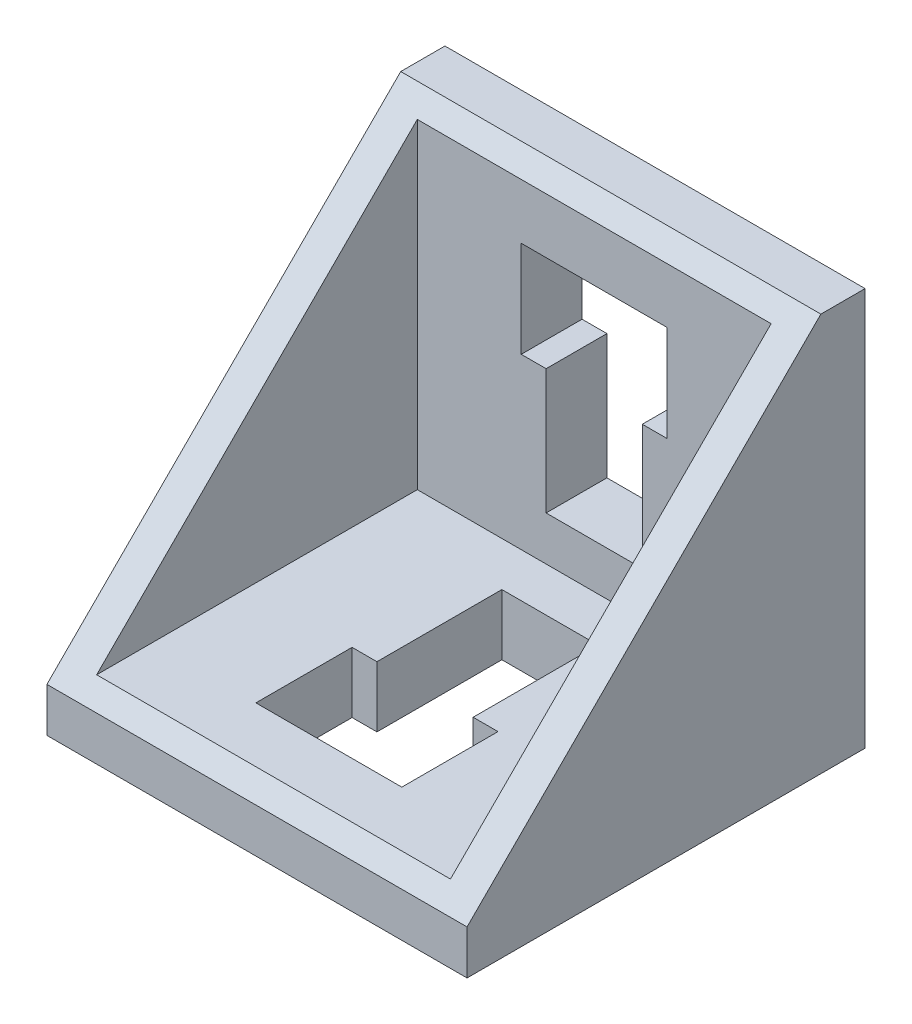
from build123d import *

# Parameters (mm, degrees)
ESTRUSIONE_ESTRUSIONE1_DEPTH = 38
TAGLIO_ESTRUSIONE1_DEPTH     = 32
TAGLIO_ESTRUSIONE3_DEPTH     = 48.370877129
TAGLIO_ESTRUSIONE4_DEPTH     = 53.671149598
TAGLIO_ESTRUSIONE5_DEPTH     = 53.671149598


with BuildPart() as part:
    # Schizzo2 → Estrusione-Estrusione1 (new body)
    with BuildSketch(Plane(origin=(0, 0, 0), x_dir=(0, 0, -1), z_dir=(1, 0, 0))):
        Polygon((-20, -20), (20, -20), (20, 20), align=None)
    extrude(amount=ESTRUSIONE_ESTRUSIONE1_DEPTH)

    # Schizzo3 → Taglio-Estrusione1 (cut)
    with BuildSketch(Plane(origin=(35, 0, 0), x_dir=(0, 0, -1), z_dir=(1, 0, 0))):
        Polygon((-20, -14.5), (14.5, 20), (14.5, -14.5), align=None)
    extrude(amount=-TAGLIO_ESTRUSIONE1_DEPTH, mode=Mode.SUBTRACT)

    # Schizzo5 → Taglio-Estrusione3 (cut, through all)
    with BuildSketch(Plane(origin=(0, 0, 0), x_dir=(0, 0, -1), z_dir=(1, 0, 0))):
        Polygon((16, 16), (20, 16), (20, 20), align=None)
        Polygon((-20, -20), (-16, -16), (-16, -20), align=None)
    extrude(amount=TAGLIO_ESTRUSIONE3_DEPTH, mode=Mode.SUBTRACT)

    # Schizzo6 → Taglio-Estrusione4 (cut, through all)
    with BuildSketch(Plane.XY.offset(-14.5)):
        Polygon((25.6, 9.5), (12.4, 9.5), (12.4, 0.8), (14.65, 0.8), (14.65, -10.5), (23.35, -10.5), (23.35, 0.8), (25.6, 0.8), align=None)
    extrude(amount=-TAGLIO_ESTRUSIONE4_DEPTH, mode=Mode.SUBTRACT)

    # Schizzo8 → Taglio-Estrusione5 (cut, through all)
    with BuildSketch(Plane(origin=(0, -14.5, 0), x_dir=(1, 0, 0), z_dir=(0, 1, 0))):
        Polygon((25.6, -9.5), (12.4, -9.5), (12.4, -0.8), (14.65, -0.8), (14.65, 10.5), (23.35, 10.5), (23.35, -0.8), (25.6, -0.8), align=None)
    extrude(amount=-TAGLIO_ESTRUSIONE5_DEPTH, mode=Mode.SUBTRACT)


solid = part.part
